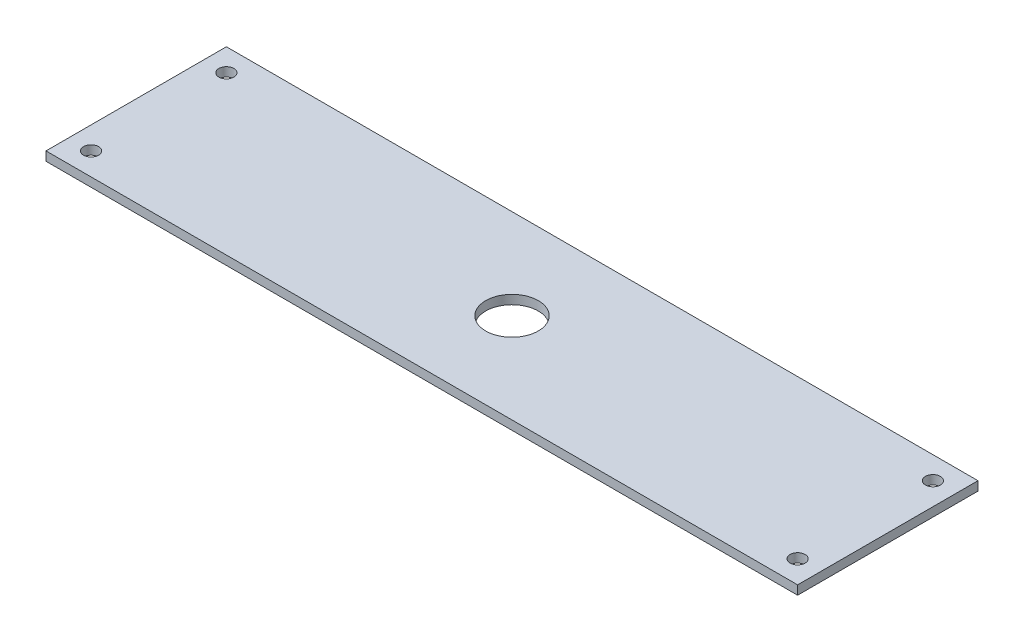
from build123d import *

# Parameters (mm, degrees)
SKETCH1_W           = 500
SKETCH1_H           = 120
SKETCH1_R           = 17.5
SKETCH1_R_2         = 5
BOSS_EXTRUDE1_DEPTH = 3


with BuildPart() as part:
    # Sketch1 → Boss-Extrude1 (new, symmetric)
    with BuildSketch(Plane(origin=(0, 0, 0), x_dir=(1, 0, 0), z_dir=(0, 1, 0))):
        Rectangle(SKETCH1_W, SKETCH1_H)
        with Locations(Location((0, 0, 0), (0, 0, 270))):
            Circle(SKETCH1_R, mode=Mode.SUBTRACT)
        with Locations(Location((-235, 45, 0), (0, 0, 270))):
            Circle(SKETCH1_R_2, mode=Mode.SUBTRACT)
        with Locations(Location((-235, -45, 0), (0, 0, 90))):
            Circle(SKETCH1_R_2, mode=Mode.SUBTRACT)
        with Locations(Location((235, 45, 0), (0, 0, 90))):
            Circle(SKETCH1_R_2, mode=Mode.SUBTRACT)
        with Locations(Location((235, -45, 0), (0, 0, 270))):
            Circle(SKETCH1_R_2, mode=Mode.SUBTRACT)
    extrude(amount=BOSS_EXTRUDE1_DEPTH, both=True)


solid = part.part
